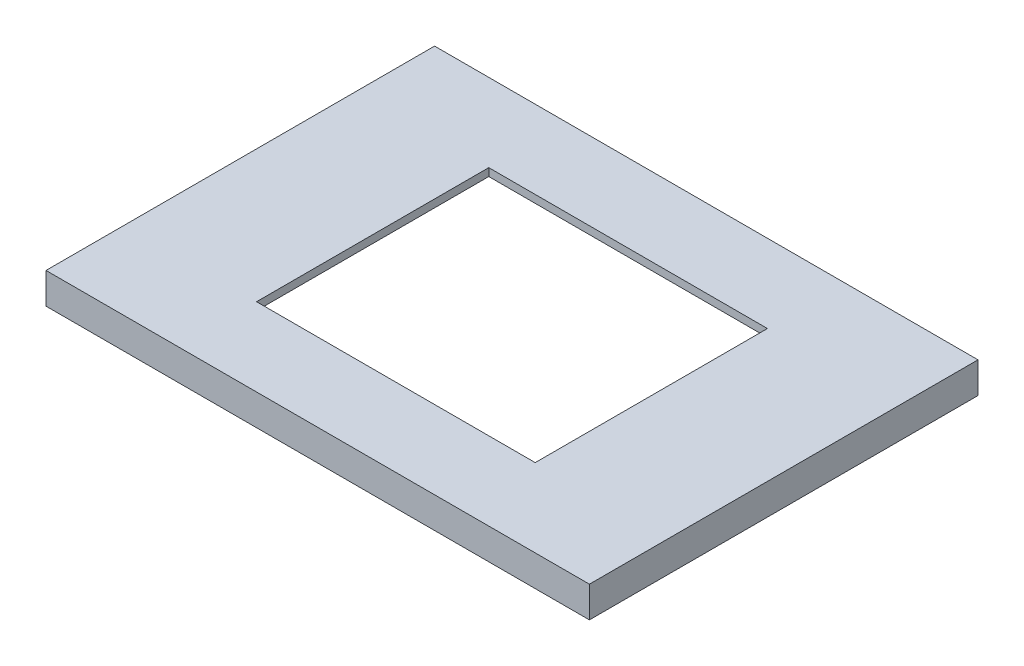
from build123d import *

# Parameters (mm, degrees)
SKETCH1_W            = 70.2
SKETCH1_H            = 50.2
SKETCH1_W_2          = 66.2
SKETCH1_H_2          = 46.2
BOSS_EXTRUDE1_DEPTH  = 1.25
SKETCH2_W            = 70.2
SKETCH2_H            = 50.2
SKETCH2_W_2          = 36
SKETCH2_H_2          = 30
BOSS_EXTRUDE2_DEPTH  = 1
SKETCH15_W           = 70.2
SKETCH15_H           = 50.2
SKETCH15_W_2         = 66.2
SKETCH15_H_2         = 46.2
BOSS_EXTRUDE3_DEPTH  = 1.75
CUT_SWEEP2_PROFILE_R = 0.5
FILLET2_R            = 0.1


with BuildPart() as part:
    # Sketch1 → Boss-Extrude1 (new body)
    with BuildSketch(Plane(origin=(0, 0, 0), x_dir=(1, 0, 0), z_dir=(0, 1, 0))):
        Rectangle(SKETCH1_W, SKETCH1_H)
        Rectangle(SKETCH1_W_2, SKETCH1_H_2, mode=Mode.SUBTRACT)
    extrude(amount=BOSS_EXTRUDE1_DEPTH)

    # Sketch2 → Boss-Extrude2 (add)
    with BuildSketch(Plane(origin=(0, 1.25, 0), x_dir=(1, 0, 0), z_dir=(0, 1, 0))):
        Rectangle(SKETCH2_W, SKETCH2_H)
        Rectangle(SKETCH2_W_2, SKETCH2_H_2, mode=Mode.SUBTRACT)
    extrude(amount=BOSS_EXTRUDE2_DEPTH)

    # Sketch15 → Boss-Extrude3 (add)
    with BuildSketch(Plane.XZ):
        Rectangle(SKETCH15_W, SKETCH15_H)
        Rectangle(SKETCH15_W_2, SKETCH15_H_2, mode=Mode.SUBTRACT)
    extrude(amount=BOSS_EXTRUDE3_DEPTH)

    # Cut-Sweep2: sweep along a path in Sketch3
    with BuildLine(Plane(origin=(0, -0.85, 0), x_dir=(-1, 0, 0), z_dir=(0, -1, 0))) as cut_sweep2_path:
        Line((-33.1, 23.1), (33.1, 23.1))
        Line((33.1, 23.1), (33.1, -23.1))
        Line((33.1, -23.1), (-33.1, -23.1))
        Line((-33.1, -23.1), (-33.1, 23.1))
    # Cut-Sweep2 profile (on start of the path) → Cut-Sweep2 (sweep, cut)
    with BuildSketch(Plane(origin=(33.1, -0.85, -23.1), x_dir=(0, 0, -1), z_dir=(-1, 0, 0))):
        Circle(CUT_SWEEP2_PROFILE_R)
    sweep(path=cut_sweep2_path.line, transition=Transition.RIGHT, mode=Mode.SUBTRACT)

    # Fillet2
    fillet2_edges = [part.edges().sort_by_distance(p)[0] for p in [
        (0, -0.35, -23.1),
        (0, -1.35, -23.1),
        (0, -1.35, 23.1),
        (0, -0.35, 23.1),
        (-33.1, -1.35, 0),
        (-33.1, -0.35, 0),
        (33.1, -1.35, 0),
        (33.1, -0.35, 0),
    ]]
    fillet(fillet2_edges, radius=FILLET2_R)


solid = part.part
